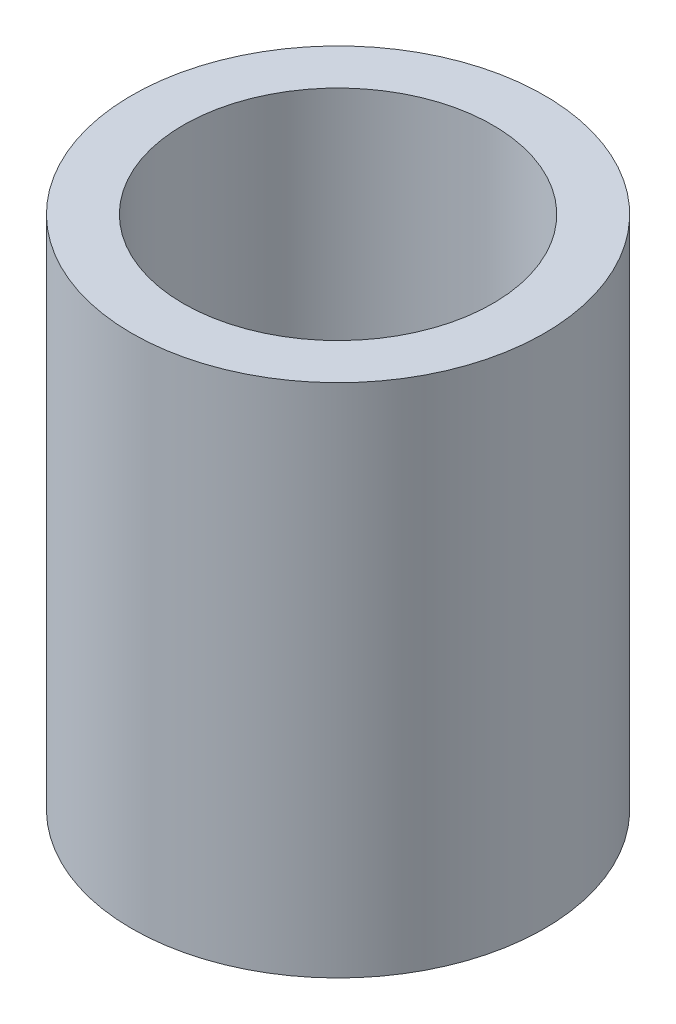
from build123d import *

# Parameters (mm, degrees)
ESQUISSE1_R        = 8
ESQUISSE1_R_2      = 6
BOSS_EXTRU_1_DEPTH = 20


with BuildPart() as part:
    # Esquisse1 → Boss.-Extru.1 (new body)
    with BuildSketch(Plane(origin=(0, 0, 0), x_dir=(1, 0, 0), z_dir=(0, 1, 0))):
        with Locations(Location((0, 0, 0), (0, 0, 270))):
            Circle(ESQUISSE1_R)
        with Locations(Location((0, 0, 0), (0, 0, 270))):
            Circle(ESQUISSE1_R_2, mode=Mode.SUBTRACT)
    extrude(amount=BOSS_EXTRU_1_DEPTH)


solid = part.part
